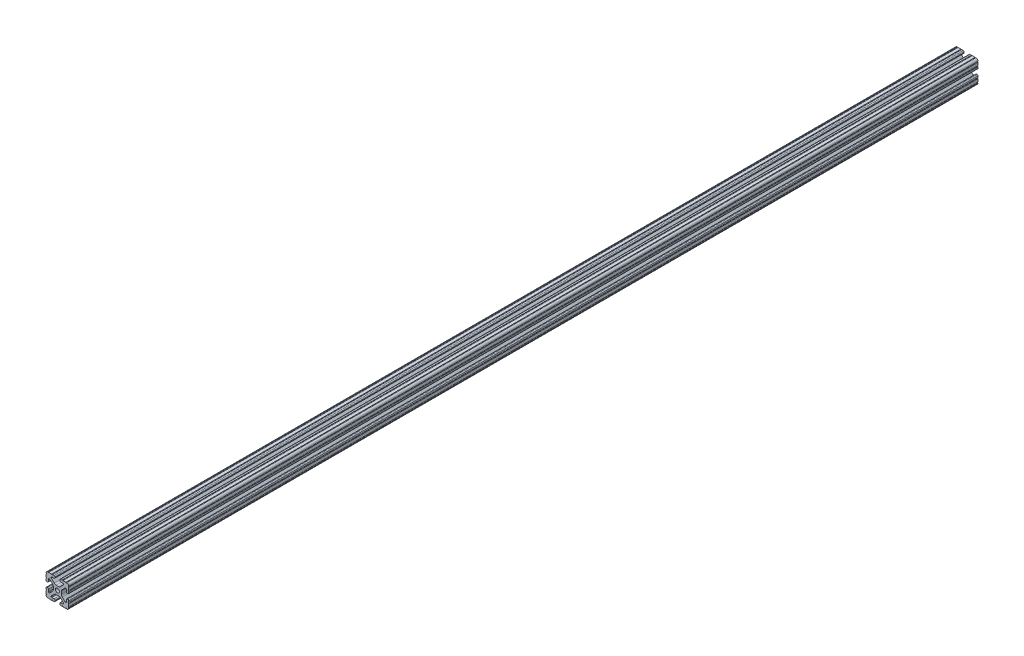
from build123d import *

# Parameters (mm, degrees)
SKETCH1_R           = 3.3274
BOSS_EXTRUDE1_DEPTH = 762


with BuildPart() as part:
    # Sketch1 → Boss-Extrude1 (new, symmetric)
    with BuildSketch(Plane.XY):
        with BuildLine():
            Line((-10.287, 13.552357131), (-10.287, 14.0843))
            ThreePointArc((-10.287, 14.0843), (-10.022898185, 14.721898185), (-9.3853, 14.986))
            Line((-9.3853, 14.986), (-5.617617549, 14.986))
            ThreePointArc((-5.617617549, 14.986), (-4.519044045, 15.441044045), (-4.064, 16.539617549))
            Line((-4.064, 16.539617549), (-4.064, 17.496382451))
            ThreePointArc((-4.064, 17.496382451), (-4.519044045, 18.594955955), (-5.617617549, 19.05))
            Line((-5.617617549, 19.05), (-7.974178704, 19.05))
            ThreePointArc((-7.974178704, 19.05), (-8.736178704, 18.288), (-9.498178704, 19.05))
            Line((-9.498178704, 19.05), (-14.327719207, 19.05))
            ThreePointArc((-14.327719207, 19.05), (-15.087603123, 18.231251131), (-15.847487039, 19.05))
            ThreePointArc((-15.847487039, 19.05), (-18.120176289, 18.120192083), (-19.05, 15.847509295))
            ThreePointArc((-19.05, 15.847509295), (-18.231250992, 15.08762539), (-19.05, 14.327741484))
            Line((-19.05, 14.327741484), (-19.05, 9.496091471))
            ThreePointArc((-19.05, 9.496091471), (-18.231250992, 8.736207565), (-19.05, 7.97632366))
            Line((-19.05, 7.97632366), (-19.05, 5.617617549))
            ThreePointArc((-19.05, 5.617617549), (-18.594955955, 4.519044045), (-17.496382451, 4.064))
            Line((-17.496382451, 4.064), (-16.539617549, 4.064))
            ThreePointArc((-16.539617549, 4.064), (-15.441044045, 4.519044045), (-14.986, 5.617617549))
            Line((-14.986, 5.617617549), (-14.986, 9.385342516))
            ThreePointArc((-14.986, 9.385342516), (-14.721898185, 10.022940701), (-14.0843, 10.287042516))
            Line((-14.0843, 10.287042516), (-13.516042086, 10.287042516))
            ThreePointArc((-13.516042086, 10.287042516), (-13.170975923, 10.218404478), (-12.878443117, 10.022939917))
            Line((-12.878443117, 10.022939917), (-8.14758008, 5.292065243))
            ThreePointArc((-8.14758008, 5.292065243), (-7.117955879, 3.751120653), (-6.7564, 1.933453584))
            Line((-6.7564, 1.933453584), (-6.7564, -1.933453584))
            ThreePointArc((-6.7564, -1.933453584), (-7.117955879, -3.751120653), (-8.14758008, -5.292065243))
            Line((-8.14758008, -5.292065243), (-12.878443117, -10.022939917))
            ThreePointArc((-12.878443117, -10.022939917), (-13.170975923, -10.218404478), (-13.516042086, -10.287042516))
            Line((-13.516042086, -10.287042516), (-14.0843, -10.287042516))
            ThreePointArc((-14.0843, -10.287042516), (-14.721898185, -10.022940701), (-14.986, -9.385342516))
            Line((-14.986, -9.385342516), (-14.986, -5.617617549))
            ThreePointArc((-14.986, -5.617617549), (-15.441044045, -4.519044045), (-16.539617549, -4.064))
            Line((-16.539617549, -4.064), (-17.496382451, -4.064))
            ThreePointArc((-17.496382451, -4.064), (-18.594955955, -4.519044045), (-19.05, -5.617617549))
            Line((-19.05, -5.617617549), (-19.05, -7.976318491))
            ThreePointArc((-19.05, -7.976318491), (-18.231250992, -8.736202396), (-19.05, -9.496086302))
            Line((-19.05, -9.496086302), (-19.05, -14.32774291))
            ThreePointArc((-19.05, -14.32774291), (-18.231250992, -15.087626816), (-19.05, -15.847510721))
            ThreePointArc((-19.05, -15.847510721), (-18.120175716, -18.120192644), (-15.847486868, -19.05))
            ThreePointArc((-15.847486868, -19.05), (-15.087602952, -18.231251131), (-14.327719036, -19.05))
            Line((-14.327719036, -19.05), (-9.496062448, -19.05))
            ThreePointArc((-9.496062448, -19.05), (-8.736178532, -18.231251131), (-7.976294616, -19.05))
            Line((-7.976294616, -19.05), (-5.617617549, -19.05))
            ThreePointArc((-5.617617549, -19.05), (-4.519044045, -18.594955955), (-4.064, -17.496382451))
            Line((-4.064, -17.496382451), (-4.064, -16.539617549))
            ThreePointArc((-4.064, -16.539617549), (-4.519044045, -15.441044045), (-5.617617549, -14.986))
            Line((-5.617617549, -14.986), (-9.3853, -14.986))
            ThreePointArc((-9.3853, -14.986), (-10.022898185, -14.721898185), (-10.287, -14.0843))
            Line((-10.287, -14.0843), (-10.287, -13.552357131))
            ThreePointArc((-10.287, -13.552357131), (-10.218362387, -13.207291992), (-10.022898969, -12.91475973))
            Line((-10.022898969, -12.91475973), (-5.252158105, -8.144007132))
            ThreePointArc((-5.252158105, -8.144007132), (-3.715177372, -7.117027388), (-1.902183975, -6.7564))
            Line((-1.902183975, -6.7564), (1.902183975, -6.7564))
            ThreePointArc((1.902183975, -6.7564), (3.715177372, -7.117027388), (5.252158105, -8.144007132))
            Line((5.252158105, -8.144007132), (10.022898969, -12.91475973))
            ThreePointArc((10.022898969, -12.91475973), (10.218362387, -13.207291992), (10.287, -13.552357131))
            Line((10.287, -13.552357131), (10.287, -14.0843))
            ThreePointArc((10.287, -14.0843), (10.022898185, -14.721898185), (9.3853, -14.986))
            Line((9.3853, -14.986), (5.617617549, -14.986))
            ThreePointArc((5.617617549, -14.986), (4.519044045, -15.441044045), (4.064, -16.539617549))
            Line((4.064, -16.539617549), (4.064, -17.496382451))
            ThreePointArc((4.064, -17.496382451), (4.519044045, -18.594955955), (5.617617549, -19.05))
            Line((5.617617549, -19.05), (7.976294616, -19.05))
            ThreePointArc((7.976294616, -19.05), (8.736178532, -18.231251131), (9.496062448, -19.05))
            Line((9.496062448, -19.05), (14.327719036, -19.05))
            ThreePointArc((14.327719036, -19.05), (15.087602952, -18.231251131), (15.847486868, -19.05))
            ThreePointArc((15.847486868, -19.05), (18.120175716, -18.120192644), (19.05, -15.847510721))
            ThreePointArc((19.05, -15.847510721), (18.231250992, -15.087626816), (19.05, -14.32774291))
            Line((19.05, -14.32774291), (19.05, -9.496086302))
            ThreePointArc((19.05, -9.496086302), (18.231250992, -8.736202396), (19.05, -7.976318491))
            Line((19.05, -7.976318491), (19.05, -5.617617549))
            ThreePointArc((19.05, -5.617617549), (18.594955955, -4.519044045), (17.496382451, -4.064))
            Line((17.496382451, -4.064), (16.539617549, -4.064))
            ThreePointArc((16.539617549, -4.064), (15.441044045, -4.519044045), (14.986, -5.617617549))
            Line((14.986, -5.617617549), (14.986, -9.385342516))
            ThreePointArc((14.986, -9.385342516), (14.721898185, -10.022940701), (14.0843, -10.287042516))
            Line((14.0843, -10.287042516), (13.516042086, -10.287042516))
            ThreePointArc((13.516042086, -10.287042516), (13.170975923, -10.218404478), (12.878443117, -10.022939917))
            Line((12.878443117, -10.022939917), (8.14758008, -5.292065243))
            ThreePointArc((8.14758008, -5.292065243), (7.117955879, -3.751120653), (6.7564, -1.933453584))
            Line((6.7564, -1.933453584), (6.7564, 1.933453584))
            ThreePointArc((6.7564, 1.933453584), (7.117955879, 3.751120653), (8.14758008, 5.292065243))
            Line((8.14758008, 5.292065243), (12.878443117, 10.022939917))
            ThreePointArc((12.878443117, 10.022939917), (13.170975923, 10.218404478), (13.516042086, 10.287042516))
            Line((13.516042086, 10.287042516), (14.0843, 10.287042516))
            ThreePointArc((14.0843, 10.287042516), (14.721898185, 10.022940701), (14.986, 9.385342516))
            Line((14.986, 9.385342516), (14.986, 5.617617549))
            ThreePointArc((14.986, 5.617617549), (15.441044045, 4.519044045), (16.539617549, 4.064))
            Line((16.539617549, 4.064), (17.496382451, 4.064))
            ThreePointArc((17.496382451, 4.064), (18.594955955, 4.519044045), (19.05, 5.617617549))
            Line((19.05, 5.617617549), (19.05, 7.97632366))
            ThreePointArc((19.05, 7.97632366), (18.231250992, 8.736207565), (19.05, 9.496091471))
            Line((19.05, 9.496091471), (19.05, 14.327741484))
            ThreePointArc((19.05, 14.327741484), (18.231250992, 15.08762539), (19.05, 15.847509295))
            ThreePointArc((19.05, 15.847509295), (18.120176289, 18.120192083), (15.847487039, 19.05))
            ThreePointArc((15.847487039, 19.05), (15.087603123, 18.231251131), (14.327719207, 19.05))
            Line((14.327719207, 19.05), (9.498178704, 19.05))
            ThreePointArc((9.498178704, 19.05), (8.736178704, 18.288), (7.974178704, 19.05))
            Line((7.974178704, 19.05), (5.617617549, 19.05))
            ThreePointArc((5.617617549, 19.05), (4.519044045, 18.594955955), (4.064, 17.496382451))
            Line((4.064, 17.496382451), (4.064, 16.539617549))
            ThreePointArc((4.064, 16.539617549), (4.519044045, 15.441044045), (5.617617549, 14.986))
            Line((5.617617549, 14.986), (9.3853, 14.986))
            ThreePointArc((9.3853, 14.986), (10.022898185, 14.721898185), (10.287, 14.0843))
            Line((10.287, 14.0843), (10.287, 13.552357131))
            ThreePointArc((10.287, 13.552357131), (10.218362387, 13.207291992), (10.022898969, 12.91475973))
            Line((10.022898969, 12.91475973), (5.252158105, 8.144007132))
            ThreePointArc((5.252158105, 8.144007132), (3.715177372, 7.117027388), (1.902183975, 6.7564))
            Line((1.902183975, 6.7564), (-1.902183975, 6.7564))
            ThreePointArc((-1.902183975, 6.7564), (-3.715177372, 7.117027388), (-5.252158105, 8.144007132))
            Line((-5.252158105, 8.144007132), (-10.022898969, 12.91475973))
            ThreePointArc((-10.022898969, 12.91475973), (-10.218362387, 13.207291992), (-10.287, 13.552357131))
        make_face()
        Circle(SKETCH1_R, mode=Mode.SUBTRACT)
    extrude(amount=BOSS_EXTRUDE1_DEPTH, both=True)


solid = part.part
